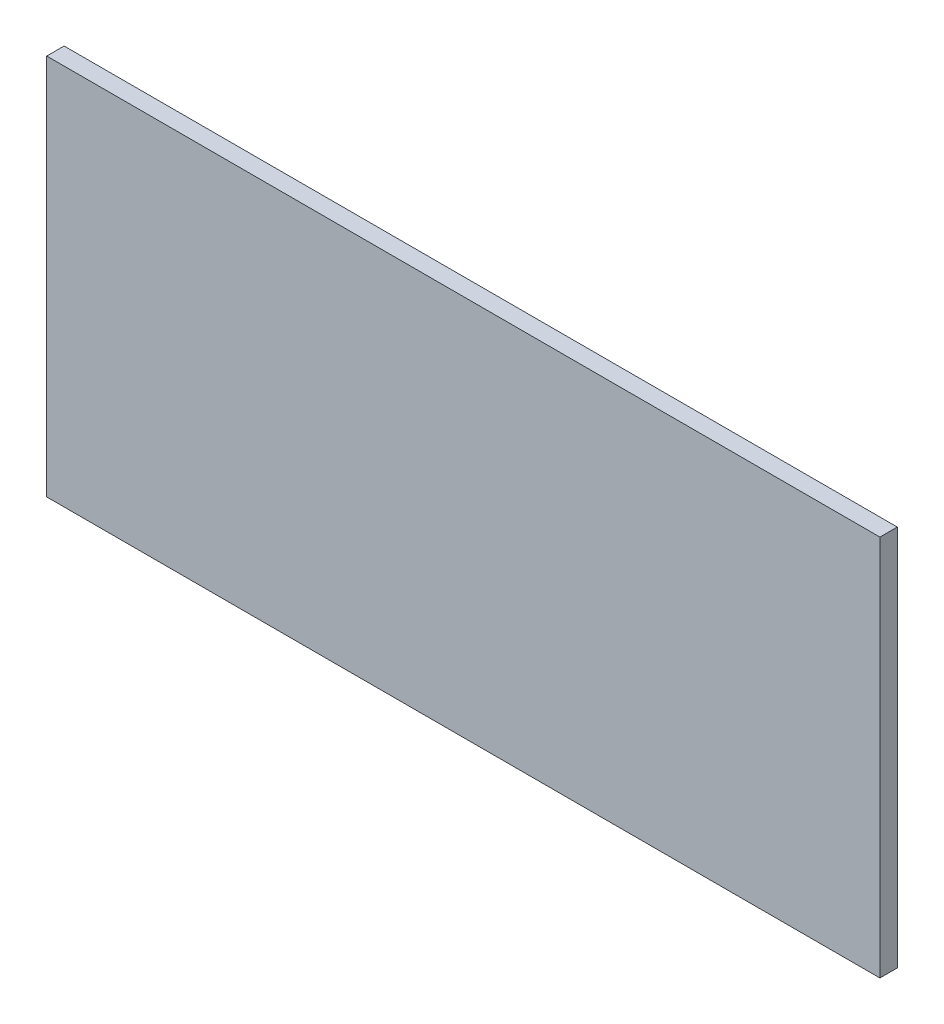
from build123d import *

# Parameters (mm, degrees)
SKETCH1_W           = 304.8
SKETCH1_H           = 139.7
BOSS_EXTRUDE1_DEPTH = 6.35


with BuildPart() as part:
    # Sketch1 → Boss-Extrude1 (new body)
    with BuildSketch(Plane.XY):
        with Locations((152.4, 69.85)):
            Rectangle(SKETCH1_W, SKETCH1_H)
    extrude(amount=BOSS_EXTRUDE1_DEPTH)


solid = part.part
